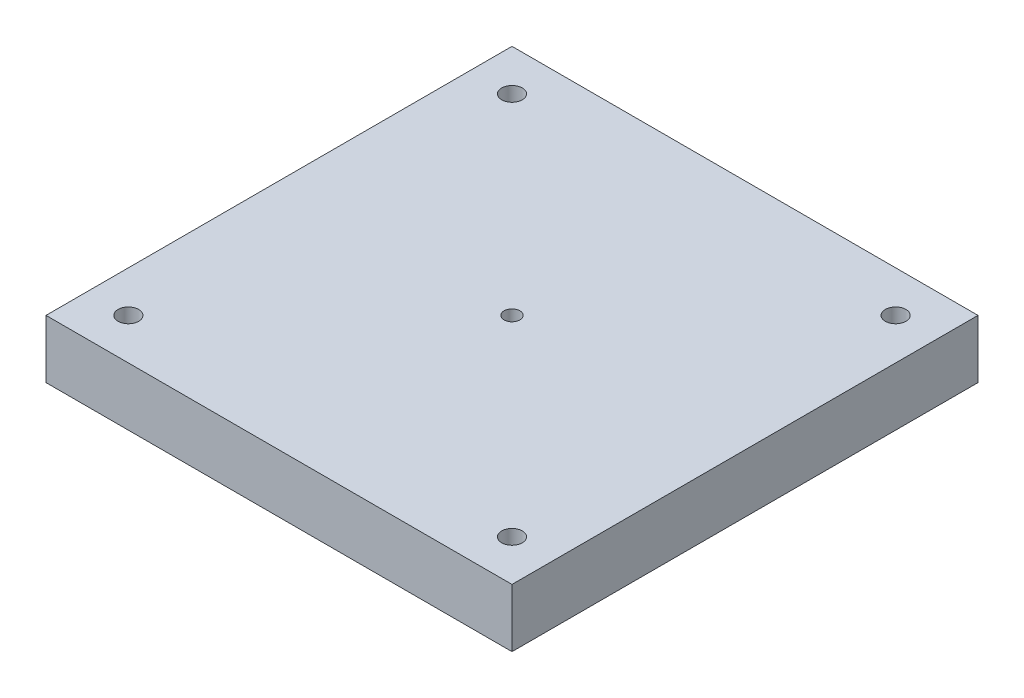
from build123d import *

# Parameters (mm, degrees)
SKETCH1_W           = 101.6
SKETCH1_H           = 101.6
BOSS_EXTRUDE1_DEPTH = 12.7
SKETCH3_R           = 2.2479
SKETCH3_R_2         = 1.7272
CUT_EXTRUDE1_DEPTH  = 73.955945611


with BuildPart() as part:
    # Sketch1 → Boss-Extrude1 (new body)
    with BuildSketch(Plane(origin=(0, 0, 0), x_dir=(1, 0, 0), z_dir=(0, 1, 0))):
        Rectangle(SKETCH1_W, SKETCH1_H)
    extrude(amount=-BOSS_EXTRUDE1_DEPTH)

    # Sketch3 → Cut-Extrude1 (cut, through all)
    with BuildSketch(Plane(origin=(0, 0, 0), x_dir=(1, 0, 0), z_dir=(0, 1, 0))):
        with Locations(Location((-41.819743879, 41.819743879, 0), (0, 0, 270))):
            Circle(SKETCH3_R)
        with Locations(Location((41.819743879, 41.819743879, 0), (0, 0, 270))):
            Circle(SKETCH3_R)
        with Locations(Location((41.819743879, -41.819743879, 0), (0, 0, 270))):
            Circle(SKETCH3_R)
        with Locations(Location((-41.819743879, -41.819743879, 0), (0, 0, 270))):
            Circle(SKETCH3_R)
        with Locations(Location((0, 0, 0), (0, 0, 270))):
            Circle(SKETCH3_R_2)
    extrude(amount=-CUT_EXTRUDE1_DEPTH, mode=Mode.SUBTRACT)


solid = part.part
